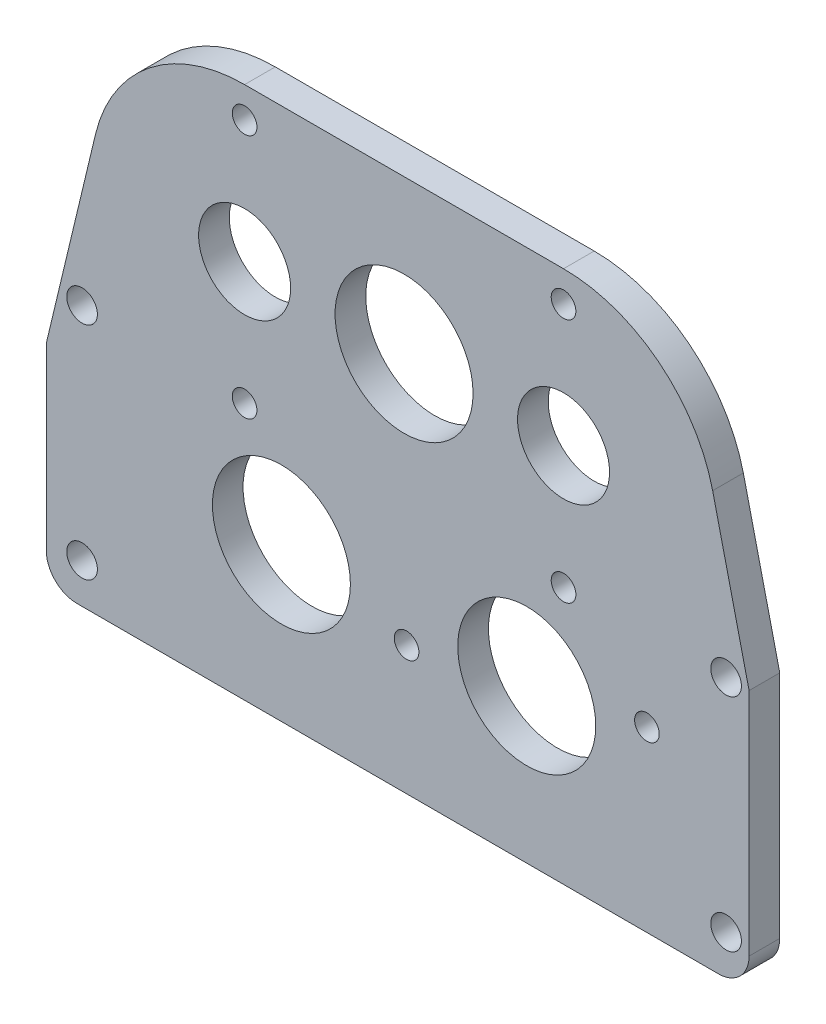
from build123d import *

# Parameters (mm, degrees)
SKETCH1_R           = 14.2875
SKETCH1_R_2         = 2.5527
SKETCH1_R_3         = 9.525
SKETCH1_R_4         = 3.175
BOSS_EXTRUDE2_DEPTH = 6.35
FILLET1_R           = 6.35


with BuildPart() as part:
    # Sketch1 → Boss-Extrude2 (new body)
    with BuildSketch(Plane.XY):
        with BuildLine():
            Line((-48.689252979, -31.75), (96.8375, -31.75))
            Line((96.8375, -31.75), (96.8375, 22.225))
            Line((96.8375, 22.225), (89.29823289, 54.293104778))
            ThreePointArc((89.29823289, 54.293104778), (78.085476575, 71.830633337), (58.42, 78.654110694))
            Line((58.42, 78.654110694), (-7.62, 78.654110694))
            ThreePointArc((-7.62, 78.654110694), (-27.285476575, 71.830633337), (-38.49823289, 54.293104778))
            Line((-38.49823289, 54.293104778), (-48.689252979, 11.70534681))
            Line((-48.689252979, 11.70534681), (-48.689252979, -31.75))
        make_face()
        Circle(SKETCH1_R, mode=Mode.SUBTRACT)
        with Locations((50.8, 0)):
            Circle(SKETCH1_R, mode=Mode.SUBTRACT)
        with Locations((25.4, 46.904110694)):
            Circle(SKETCH1_R, mode=Mode.SUBTRACT)
        with Locations((-7.62, 72.304110694)):
            Circle(SKETCH1_R_2, mode=Mode.SUBTRACT)
        with Locations((-7.62, 21.504110694)):
            Circle(SKETCH1_R_2, mode=Mode.SUBTRACT)
        with Locations((58.42, 72.304110694)):
            Circle(SKETCH1_R_2, mode=Mode.SUBTRACT)
        with Locations((58.42, 21.504110694)):
            Circle(SKETCH1_R_2, mode=Mode.SUBTRACT)
        with Locations((58.42, 46.904110694)):
            Circle(SKETCH1_R_3, mode=Mode.SUBTRACT)
        with Locations((-7.62, 46.904110694)):
            Circle(SKETCH1_R_3, mode=Mode.SUBTRACT)
        with Locations((75.683179842, 5.09778)):
            Circle(SKETCH1_R_2, mode=Mode.SUBTRACT)
        with Locations((25.916820158, -5.09778)):
            Circle(SKETCH1_R_2, mode=Mode.SUBTRACT)
        with Locations((-41.275, 22.225)):
            Circle(SKETCH1_R_4, mode=Mode.SUBTRACT)
        with Locations((92.075, 22.225)):
            Circle(SKETCH1_R_4, mode=Mode.SUBTRACT)
        with Locations((-41.275, -23.495)):
            Circle(SKETCH1_R_4, mode=Mode.SUBTRACT)
        with Locations((92.075, -23.495)):
            Circle(SKETCH1_R_4, mode=Mode.SUBTRACT)
    extrude(amount=BOSS_EXTRUDE2_DEPTH)

    # Fillet1
    fillet1_edges = [part.edges().sort_by_distance(p)[0] for p in [
        (96.8375, -31.75, 3.175),
        (-48.689252979, -31.75, 3.175),
    ]]
    fillet(fillet1_edges, radius=FILLET1_R)


solid = part.part
